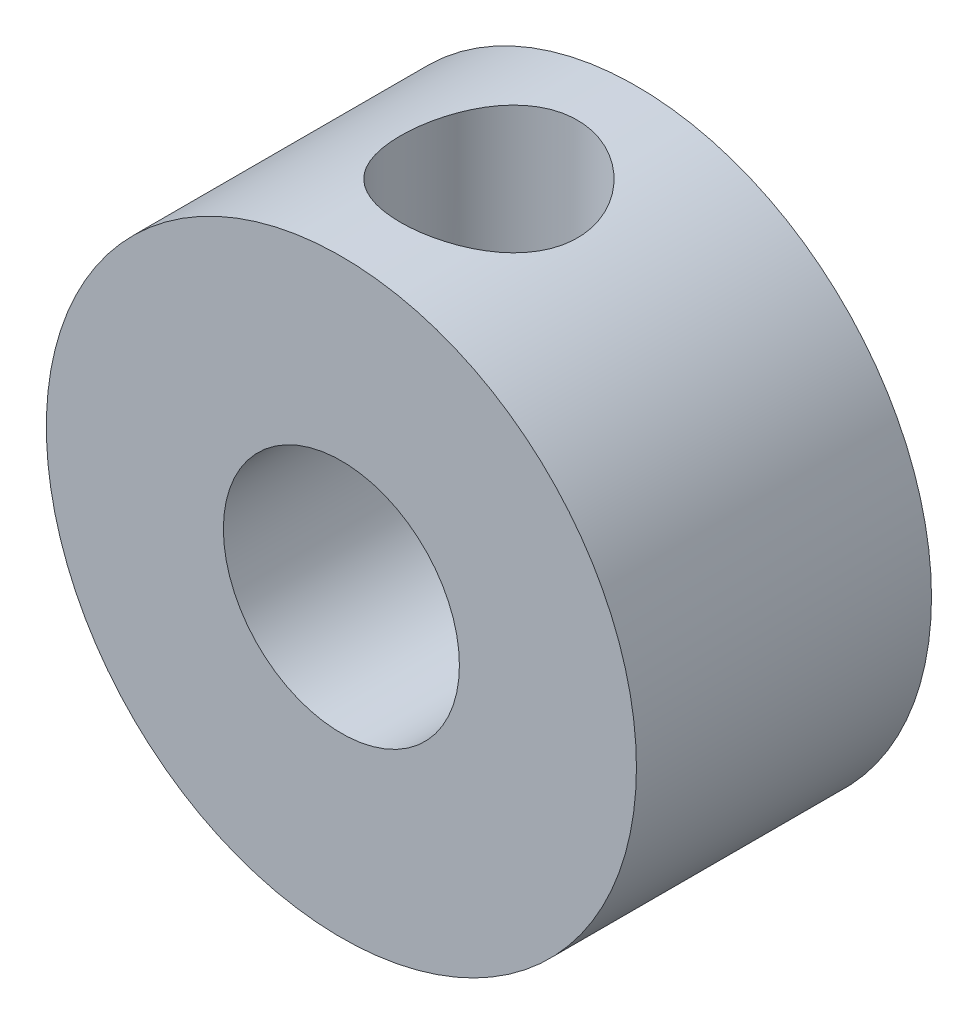
from build123d import *

# Parameters (mm, degrees)
SKETCH1_R           = 5
SKETCH1_R_2         = 2
BOSS_EXTRUDE1_DEPTH = 2.5
SKETCH3_R           = 1.5
CUT_EXTRUDE1_DEPTH  = 5


with BuildPart() as part:
    # Sketch1 → Boss-Extrude1 (new, symmetric)
    with BuildSketch(Plane.XY):
        Circle(SKETCH1_R)
        Circle(SKETCH1_R_2, mode=Mode.SUBTRACT)
    extrude(amount=BOSS_EXTRUDE1_DEPTH, both=True)

    # Sketch3 → Cut-Extrude1 (cut)
    with BuildSketch(Plane(origin=(0, 5, 0), x_dir=(1, 0, 0), z_dir=(0, 1, 0))):
        with Locations(Location((0, 0, 0), (0, 0, 270))):
            Circle(SKETCH3_R)
    extrude(amount=-CUT_EXTRUDE1_DEPTH, mode=Mode.SUBTRACT)


solid = part.part
